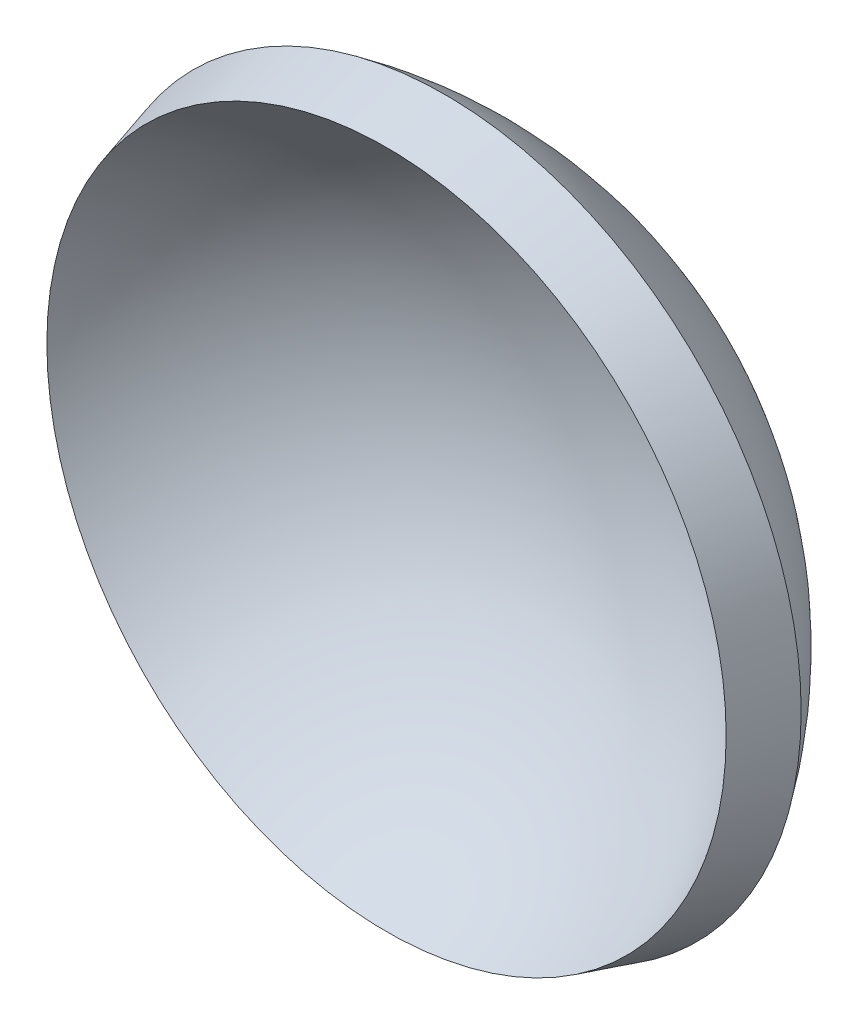
from build123d import *


with BuildPart() as part:
    # 草图2 → 旋转2 (revolve)
    with BuildSketch(Plane(origin=(0, 0, 0), x_dir=(1, 0, 0), z_dir=(0, 1, 0))):
        with BuildLine():
            Line((7.155, -28.160102794), (6.82423803, -29.336366111))
            ThreePointArc((6.82423803, -29.336366111), (3.968922121, -26.371939979), (0, -25.281844373))
            Line((0, -25.281844373), (0, -24.401844373))
            ThreePointArc((0, -24.401844373), (4.040994041, -25.398570222), (7.155, -28.160102794))
        make_face()
    revolve(axis=Axis((0, 0, 24.401844373), (0, 0, -1)))


solid = part.part
